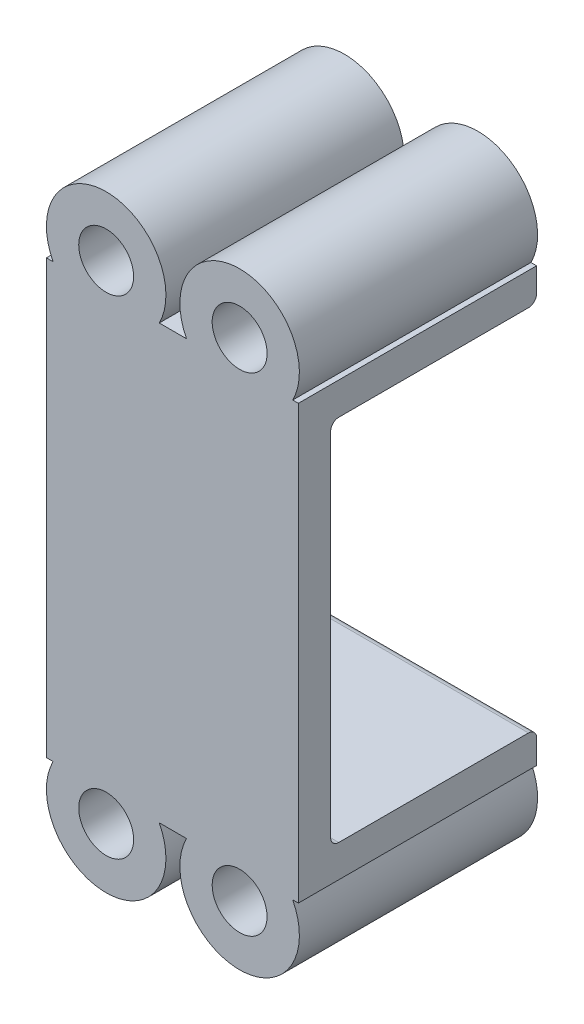
from build123d import *

# Parameters (mm, degrees)
SCHIZZO1_W                   = 15.6
SCHIZZO1_H                   = 22.8
ESTRUSIONE_ESTRUSIONE1_DEPTH = 2
SCHIZZO7_R                   = 1.7
ESTRUSIONE_ESTRUSIONE8_DEPTH = 14.75
RACCORDO2_R                  = 0.5


with BuildPart() as part:
    # Schizzo1 → Estrusione-Estrusione1 (new body)
    with BuildSketch(Plane.XY):
        with Locations((-0.031567178, 0)):
            Rectangle(SCHIZZO1_W, SCHIZZO1_H)
    extrude(amount=ESTRUSIONE_ESTRUSIONE1_DEPTH)

    # Schizzo7 → Estrusione-Estrusione8 (add)
    # profile 1 of 2: a face of its own
    with BuildSketch(Plane.XY.offset(2)):
        with BuildLine():
            Line((7.768432822, 13.4), (7.417902523, 13.4))
            ThreePointArc((7.417902523, 13.4), (4.131567178, 18.8), (0.845231833, 13.4))
            Line((0.845231833, 13.4), (-0.845231833, 13.4))
            ThreePointArc((-0.845231833, 13.4), (-4.131567178, 18.8), (-7.417902523, 13.4))
            Line((-7.417902523, 13.4), (-7.831567178, 13.4))
            Line((-7.831567178, 13.4), (-7.831567178, 11.4))
            Line((-7.831567178, 11.4), (7.768432822, 11.4))
            Line((7.768432822, 11.4), (7.768432822, 13.4))
        make_face()
        with Locations((4.131567178, 15.1)):
            Circle(SCHIZZO7_R, mode=Mode.SUBTRACT)
        with Locations(Location((-4.131567178, 15.1, 0), (0, 0, 180))):
            Circle(SCHIZZO7_R, mode=Mode.SUBTRACT)
    # profile 2 of 2: a face of its own
    with BuildSketch(Plane.XY.offset(2)):
        with BuildLine():
            Line((0.845231833, -13.4), (-0.845231833, -13.4))
            ThreePointArc((-0.845231833, -13.4), (-4.131567178, -18.8), (-7.417902523, -13.4))
            Line((-7.417902523, -13.4), (-7.831567178, -13.4))
            Line((-7.831567178, -13.4), (-7.831567178, -11.4))
            Line((-7.831567178, -11.4), (7.768432822, -11.4))
            Line((7.768432822, -11.4), (7.768432822, -13.4))
            Line((7.768432822, -13.4), (7.417902523, -13.4))
            ThreePointArc((7.417902523, -13.4), (4.131567178, -18.8), (0.845231833, -13.4))
        make_face()
        with Locations((-4.131567178, -15.1)):
            Circle(SCHIZZO7_R, mode=Mode.SUBTRACT)
        with Locations(Location((4.131567178, -15.1, 0), (0, 0, 180))):
            Circle(SCHIZZO7_R, mode=Mode.SUBTRACT)
    extrude(amount=-ESTRUSIONE_ESTRUSIONE8_DEPTH)

    # Raccordo2
    raccordo2_edges = [part.edges().sort_by_distance(p)[0] for p in [
        (-0.031567178, 11.4, 0),
        (-0.031567178, 11.4, -12.75),
        (-0.031567178, -11.4, 0),
        (-0.031567178, -11.4, -12.75),
    ]]
    fillet(raccordo2_edges, radius=RACCORDO2_R)


solid = part.part
